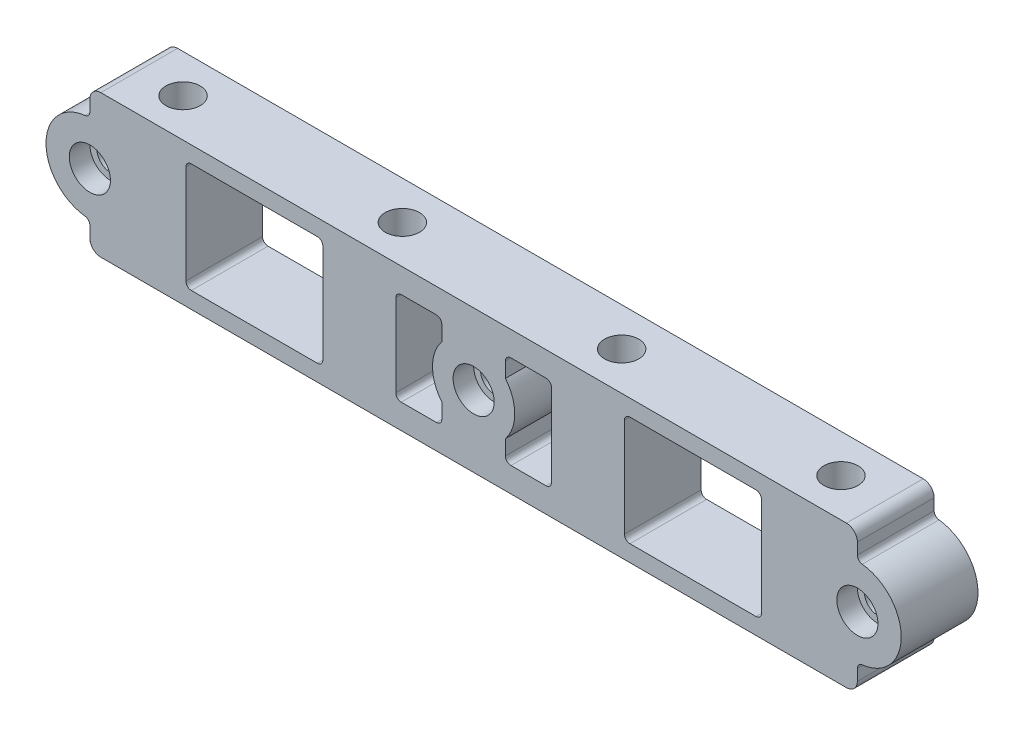
from build123d import *

# Parameters (mm, degrees)
SKETCH1_W           = 203.2
SKETCH1_H           = 17.78
SKETCH1_R           = 3.96875
BOSS_EXTRUDE1_DEPTH = 33.02
SKETCH2_R           = 3.175
CUT_EXTRUDE1_DEPTH  = 17.78
SKETCH3_R           = 4.7625
CUT_EXTRUDE2_DEPTH  = 4.7752
CUT_EXTRUDE3_DEPTH  = 17.78
CUT_EXTRUDE4_DEPTH  = 17.78
FILLET1_R           = 2.54


with BuildPart() as part:
    # Sketch1 → Boss-Extrude1 (new body)
    with BuildSketch(Plane(origin=(0, 0, 0), x_dir=(1, 0, 0), z_dir=(0, 1, 0))):
        with Locations((0, 8.89)):
            Rectangle(SKETCH1_W, SKETCH1_H)
        with Locations(Location((76.2, 8.89, 0), (0, 0, 270))):
            Circle(SKETCH1_R, mode=Mode.SUBTRACT)
        with Locations(Location((25.4, 8.89, 0), (0, 0, 270))):
            Circle(SKETCH1_R, mode=Mode.SUBTRACT)
        with Locations(Location((-25.4, 8.89, 0), (0, 0, 270))):
            Circle(SKETCH1_R, mode=Mode.SUBTRACT)
        with Locations(Location((-76.2, 8.89, 0), (0, 0, 270))):
            Circle(SKETCH1_R, mode=Mode.SUBTRACT)
    extrude(amount=-BOSS_EXTRUDE1_DEPTH)

    # Sketch2 → Cut-Extrude1 (cut)
    with BuildSketch(Plane.XY):
        with Locations((88.9, -16.51)):
            Circle(SKETCH2_R)
        with Locations((0, -16.51)):
            Circle(SKETCH2_R)
        with Locations((-88.9, -16.51)):
            Circle(SKETCH2_R)
    extrude(amount=-CUT_EXTRUDE1_DEPTH, mode=Mode.SUBTRACT)

    # Sketch3 → Cut-Extrude2 (cut)
    with BuildSketch(Plane.XY):
        with Locations((88.9, -16.51)):
            Circle(SKETCH3_R)
        with Locations((0, -16.51)):
            Circle(SKETCH3_R)
        with Locations((-88.9, -16.51)):
            Circle(SKETCH3_R)
    extrude(amount=-CUT_EXTRUDE2_DEPTH, mode=Mode.SUBTRACT)

    # Sketch4 → Cut-Extrude3 (cut)
    with BuildSketch(Plane.XY):
        with BuildLine():
            Line((-36.195, -29.21), (-65.405, -29.21))
            ThreePointArc((-65.405, -29.21), (-66.303025612, -28.838025612), (-66.675, -27.94))
            Line((-66.675, -27.94), (-66.675, -5.08))
            ThreePointArc((-66.675, -5.08), (-66.303025612, -4.181974388), (-65.405, -3.81))
            Line((-65.405, -3.81), (-36.195, -3.81))
            ThreePointArc((-36.195, -3.81), (-35.296974388, -4.181974388), (-34.925, -5.08))
            Line((-34.925, -5.08), (-34.925, -27.94))
            ThreePointArc((-34.925, -27.94), (-35.296974388, -28.838025612), (-36.195, -29.21))
        make_face()
        with BuildLine():
            Line((-8.636, -27.305), (-16.764, -27.305))
            ThreePointArc((-16.764, -27.305), (-17.662025612, -26.933025612), (-18.034, -26.035))
            Line((-18.034, -26.035), (-18.034, -6.985))
            ThreePointArc((-18.034, -6.985), (-17.662025612, -6.086974388), (-16.764, -5.715))
            Line((-16.764, -5.715), (-8.636, -5.715))
            ThreePointArc((-8.636, -5.715), (-7.737974388, -6.086974388), (-7.366, -6.985))
            Line((-7.366, -6.985), (-7.366, -10.471153339))
            ThreePointArc((-7.366, -10.471153339), (-9.525, -16.51), (-7.366, -22.548846661))
            Line((-7.366, -22.548846661), (-7.366, -26.035))
            ThreePointArc((-7.366, -26.035), (-7.737974388, -26.933025612), (-8.636, -27.305))
        make_face()
        with BuildLine():
            Line((36.195, -3.81), (65.405, -3.81))
            ThreePointArc((65.405, -3.81), (66.303025612, -4.181974388), (66.675, -5.08))
            Line((66.675, -5.08), (66.675, -27.94))
            ThreePointArc((66.675, -27.94), (66.303025612, -28.838025612), (65.405, -29.21))
            Line((65.405, -29.21), (36.195, -29.21))
            ThreePointArc((36.195, -29.21), (35.296974388, -28.838025612), (34.925, -27.94))
            Line((34.925, -27.94), (34.925, -5.08))
            ThreePointArc((34.925, -5.08), (35.296974388, -4.181974388), (36.195, -3.81))
        make_face()
        with BuildLine():
            Line((7.366, -26.035), (7.366, -22.548846661))
            ThreePointArc((7.366, -22.548846661), (9.525, -16.51), (7.366, -10.471153339))
            Line((7.366, -10.471153339), (7.366, -6.985))
            ThreePointArc((7.366, -6.985), (7.737974388, -6.086974388), (8.636, -5.715))
            Line((8.636, -5.715), (16.764, -5.715))
            ThreePointArc((16.764, -5.715), (17.662025612, -6.086974388), (18.034, -6.985))
            Line((18.034, -6.985), (18.034, -26.035))
            ThreePointArc((18.034, -26.035), (17.662025612, -26.933025612), (16.764, -27.305))
            Line((16.764, -27.305), (8.636, -27.305))
            ThreePointArc((8.636, -27.305), (7.737974388, -26.933025612), (7.366, -26.035))
        make_face()
    extrude(amount=-CUT_EXTRUDE3_DEPTH, mode=Mode.SUBTRACT)

    # Sketch5 → Cut-Extrude4 (cut)
    with BuildSketch(Plane.XY):
        with BuildLine():
            Line((88.9, -27.869225326), (88.9, -33.02))
            Line((88.9, -33.02), (101.6, -33.02))
            Line((101.6, -33.02), (101.6, 0))
            Line((101.6, 0), (88.9, 0))
            Line((88.9, 0), (88.9, -5.150774674))
            ThreePointArc((88.9, -5.150774674), (89.22339789, -5.997441341), (90.028888889, -6.412910822))
            ThreePointArc((90.028888889, -6.412910822), (99.06, -16.51), (90.028888889, -26.607089178))
            ThreePointArc((90.028888889, -26.607089178), (89.22339789, -27.022558659), (88.9, -27.869225326))
        make_face()
        with BuildLine():
            Line((-88.9, -5.150774674), (-88.9, 0))
            Line((-88.9, 0), (-101.6, 0))
            Line((-101.6, 0), (-101.6, -33.02))
            Line((-101.6, -33.02), (-88.9, -33.02))
            Line((-88.9, -33.02), (-88.9, -27.869225326))
            ThreePointArc((-88.9, -27.869225326), (-89.22339789, -27.022558659), (-90.028888889, -26.607089178))
            ThreePointArc((-90.028888889, -26.607089178), (-99.06, -16.51), (-90.028888889, -6.412910822))
            ThreePointArc((-90.028888889, -6.412910822), (-89.22339789, -5.997441341), (-88.9, -5.150774674))
        make_face()
    extrude(amount=-CUT_EXTRUDE4_DEPTH, mode=Mode.SUBTRACT)

    # Fillet1
    fillet1_edges = [part.edges().sort_by_distance(p)[0] for p in [
        (88.9, 0, -8.89),
        (88.9, -33.02, -8.89),
        (-88.9, 0, -8.89),
        (-88.9, -33.02, -8.89),
    ]]
    fillet(fillet1_edges, radius=FILLET1_R)


solid = part.part
